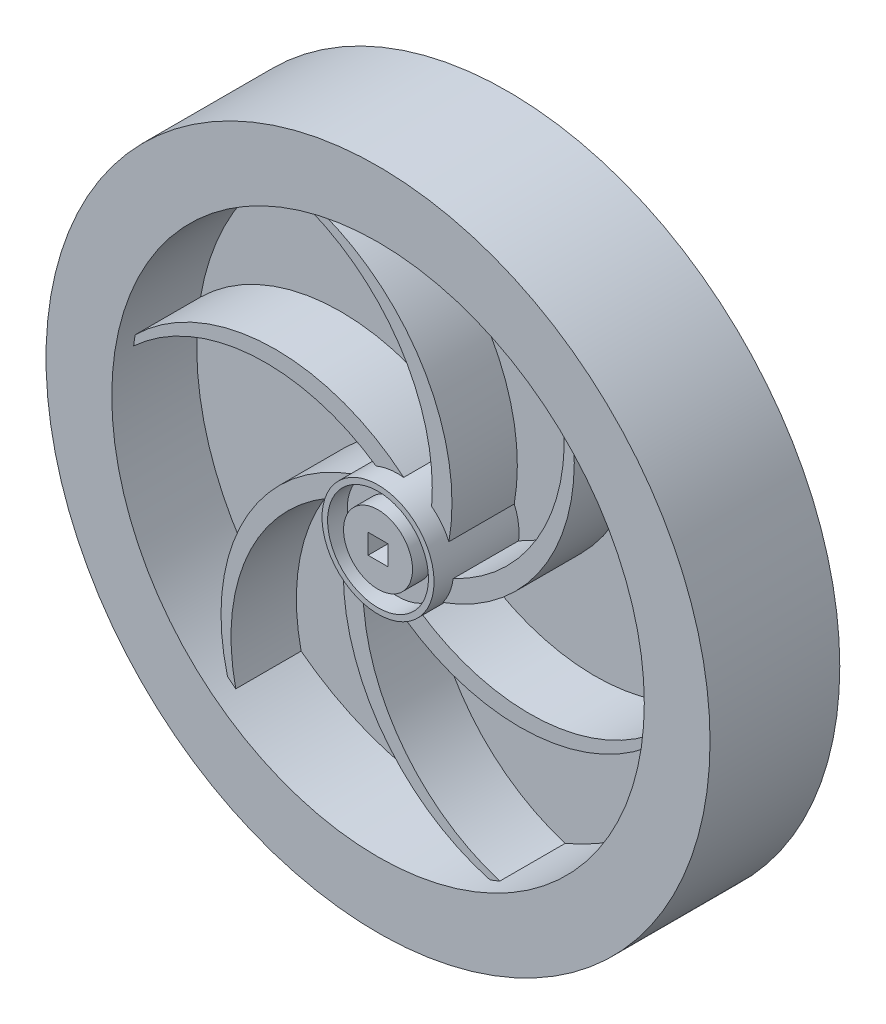
from build123d import *
from build123d.topology import SkipClean

# Parameters (mm, degrees)
SKETCH1_R           = 50.8
SKETCH1_R_2         = 8.57
SKETCH1_R_3         = 7.72
SKETCH1_R_4         = 5.275
SKETCH1_W           = 3.05
SKETCH1_H           = 3.05
BOSS_EXTRUDE1_DEPTH = 19.85
SKETCH2_R           = 7.72
SKETCH2_R_2         = 5.275
CUT_EXTRUDE1_DEPTH  = 3
SKETCH3_R           = 40.74
SKETCH3_R_2         = 8.57
CUT_EXTRUDE2_DEPTH  = 3
CUT_EXTRUDE3_START  = -3
SKETCH4_R           = 45.337827748
SKETCH4_R_2         = 8.57
SKETCH4_R_3         = 7.72
SKETCH4_R_4         = 5.275
CUT_EXTRUDE3_DEPTH  = 3
CUT_EXTRUDE4_DEPTH  = 10


with BuildPart() as part:
    # Sketch1 → Boss-Extrude1 (new body)
    # profile 1 of 4: a face of its own
    with BuildSketch(Plane.XY):
        Circle(SKETCH1_R)
        Circle(SKETCH1_R_2, mode=Mode.SUBTRACT)
    # profile 2 of 4: a face of its own
    with BuildSketch(Plane.XY):
        Circle(SKETCH1_R_2)
        Circle(SKETCH1_R_3, mode=Mode.SUBTRACT)
    # profile 3 of 4: a face of its own
    with BuildSketch(Plane.XY):
        Circle(SKETCH1_R_3)
        Circle(SKETCH1_R_4, mode=Mode.SUBTRACT)
    # profile 4 of 4: a face of its own
    with BuildSketch(Plane.XY):
        Circle(SKETCH1_R_4)
        Rectangle(SKETCH1_W, SKETCH1_H, mode=Mode.SUBTRACT)
    extrude(amount=BOSS_EXTRUDE1_DEPTH)

    # Sketch2 → Cut-Extrude1 (cut)
    with BuildSketch(Plane.XY.offset(19.85)):
        Circle(SKETCH2_R)
        Circle(SKETCH2_R_2, mode=Mode.SUBTRACT)
    extrude(amount=-CUT_EXTRUDE1_DEPTH, mode=Mode.SUBTRACT)

    # Sketch3 → Cut-Extrude2 (cut)
    with BuildSketch(Plane.XY.offset(19.85)):
        Circle(SKETCH3_R)
        Circle(SKETCH3_R_2, mode=Mode.SUBTRACT)
    extrude(amount=-CUT_EXTRUDE2_DEPTH, mode=Mode.SUBTRACT)

    # Sketch4 → Cut-Extrude3 (cut)
    # profile 1 of 2: a face of its own
    with BuildSketch(Plane(origin=(0, 0, 0), x_dir=(-1, 0, 0), z_dir=(0, 0, -1)).offset(CUT_EXTRUDE3_START)):
        Circle(SKETCH4_R)
        with Locations(Location((0, 0, 0), (0, 0, 180))):
            Circle(SKETCH4_R_2, mode=Mode.SUBTRACT)
    # profile 2 of 2: a face of its own
    with BuildSketch(Plane(origin=(0, 0, 0), x_dir=(-1, 0, 0), z_dir=(0, 0, -1)).offset(CUT_EXTRUDE3_START)):
        with Locations(Location((0, 0, 0), (0, 0, 180))):
            Circle(SKETCH4_R_3)
        with Locations(Location((0, 0, 0), (0, 0, 180))):
            Circle(SKETCH4_R_4, mode=Mode.SUBTRACT)
    extrude(amount=CUT_EXTRUDE3_DEPTH, mode=Mode.SUBTRACT)

    # Sketch5 → Cut-Extrude4 (cut)
    with SkipClean():  # the faces are left unmerged after this step: merging them gives an invalid solid
        with BuildSketch(Plane.XY.offset(16.85)):
            with BuildLine():
                ThreePointArc((-40.155721572, 6.875), (-19.932515852, 15.660919221), (0.928253594, 8.519580111))
                ThreePointArc((0.928253594, 8.519580111), (3.182932587, 7.956999444), (5.20358481, 6.809376265))
                ThreePointArc((5.20358481, 6.809376265), (0.190794067, 25.869806658), (-15.630243014, 37.622375036))
                ThreePointArc((-15.630243014, 37.622375036), (-31.849155862, 25.404308117), (-40.155721572, 6.875))
            make_face()
            with BuildLine():
                ThreePointArc((-14.123936135, 38.213374989), (3.596495966, 25.0925247), (7.842299603, 3.455898861))
                ThreePointArc((7.842299603, 3.455898861), (8.386101824, 1.7658415), (8.57, 0))
                ThreePointArc((8.57, 0), (8.552202829, -0.552020624), (8.498885235, -1.101748504))
                ThreePointArc((8.498885235, -1.101748504), (22.499306791, 12.76967082), (24.766811024, 32.347375036))
                ThreePointArc((24.766811024, 32.347375036), (6.076198264, 40.284332124), (-14.123936135, 38.213374989))
            make_face()
            with BuildLine():
                ThreePointArc((6.914046008, -5.063681249), (5.299497363, -6.735000201), (3.295300425, -7.911124769))
                ThreePointArc((3.295300425, -7.911124769), (22.308512723, -13.100135838), (40.397054039, -5.275))
                ThreePointArc((40.397054039, -5.275), (40.654173104, -2.643068148), (40.74, 0))
                ThreePointArc((40.74, 0), (36.880093131, 17.30914009), (26.031785437, 31.338374989))
                ThreePointArc((26.031785437, 31.338374989), (23.529011818, 9.431605478), (6.914046008, -5.063681249))
            make_face()
            with BuildLine():
                ThreePointArc((-0.928253594, -8.519580111), (-3.182932587, -7.956999444), (-5.20358481, -6.809376265))
                ThreePointArc((-5.20358481, -6.809376265), (-0.190794067, -25.869806658), (15.630243014, -37.622375036))
                ThreePointArc((15.630243014, -37.622375036), (31.849155862, -25.404308117), (40.155721572, -6.875))
                ThreePointArc((40.155721572, -6.875), (19.932515852, -15.660919221), (-0.928253594, -8.519580111))
            make_face()
            with BuildLine():
                ThreePointArc((-7.842299603, -3.455898861), (-8.48242995, -1.221999243), (-8.498885235, 1.101748504))
                ThreePointArc((-8.498885235, 1.101748504), (-22.499306791, -12.76967082), (-24.766811024, -32.347375036))
                ThreePointArc((-24.766811024, -32.347375036), (-6.076198264, -40.284332124), (14.123936135, -38.213374989))
                ThreePointArc((14.123936135, -38.213374989), (-3.596495966, -25.0925247), (-7.842299603, -3.455898861))
            make_face()
            with BuildLine():
                ThreePointArc((-6.914046008, 5.063681249), (-5.299497363, 6.735000201), (-3.295300425, 7.911124769))
                ThreePointArc((-3.295300425, 7.911124769), (-22.308512723, 13.100135838), (-40.397054039, 5.275))
                ThreePointArc((-40.397054039, 5.275), (-37.925354126, -14.880024007), (-26.031785437, -31.338374989))
                ThreePointArc((-26.031785437, -31.338374989), (-23.529011818, -9.431605478), (-6.914046008, 5.063681249))
            make_face()
        extrude(amount=-CUT_EXTRUDE4_DEPTH, mode=Mode.SUBTRACT)


solid = part.part
